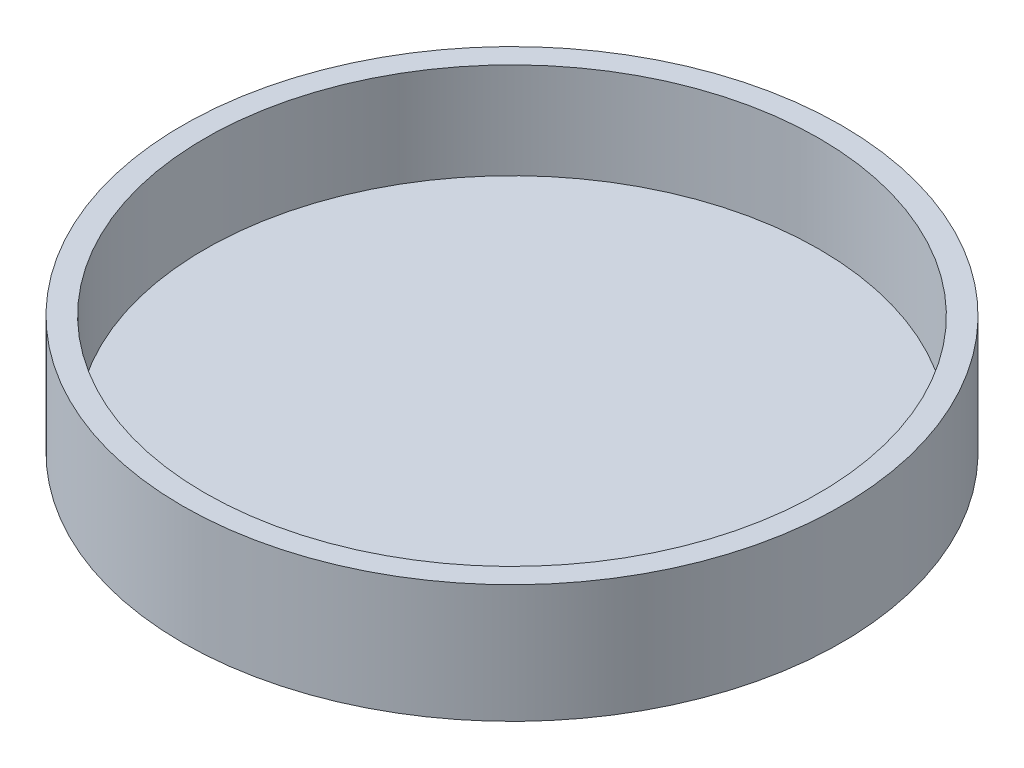
from build123d import *

# Parameters (mm, degrees)
YUVA_1L_HALKA_1_START = 6.5
SKETCH1_R             = 51.5
YUVA_1L_HALKA_1_DEPTH = 18.5
YUVA_1L_HALKA_2_START = 10
SKETCH2_R             = 48
YUVA_1L_HALKA_2_DEPTH = 16


with BuildPart() as part:
    # Sketch1 → YUVA_1L_halka_1 (new body)
    with BuildSketch(Plane(origin=(0, 0, 0), x_dir=(1, 0, 0), z_dir=(0, 1, 0)).offset(YUVA_1L_HALKA_1_START)):
        with Locations(Location((0, 0, 0), (0, 0, 270))):
            Circle(SKETCH1_R)
    extrude(amount=YUVA_1L_HALKA_1_DEPTH)

    # Sketch2 → YUVA_1L_halka_2 (cut)
    with BuildSketch(Plane(origin=(0, 0, 0), x_dir=(1, 0, 0), z_dir=(0, 1, 0)).offset(YUVA_1L_HALKA_2_START)):
        with Locations(Location((0, 0, 0), (0, 0, 270))):
            Circle(SKETCH2_R)
    extrude(amount=YUVA_1L_HALKA_2_DEPTH, mode=Mode.SUBTRACT)


solid = part.part
